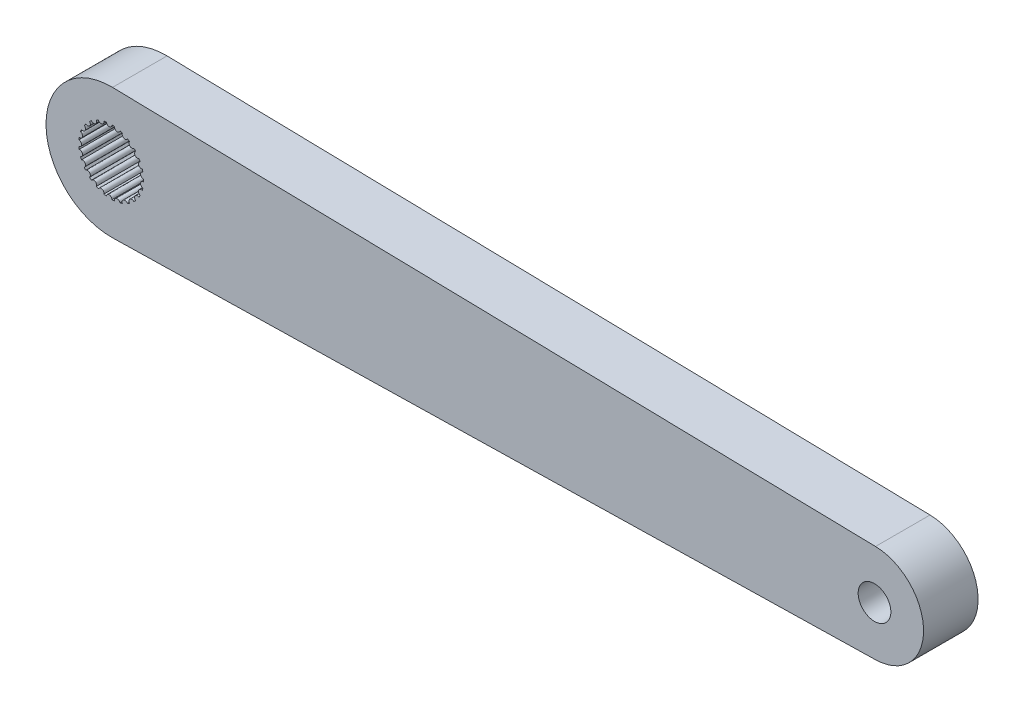
from build123d import *

# Parameters (mm, degrees)
ESQUISSE1_R        = 2.975
ESQUISSE1_R_2      = 1.5
BOSS_EXTRU_1_DEPTH = 5
ESQUISSE2_R        = 0.26
BOSS_EXTRU_2_DEPTH = 5


with BuildPart() as part:
    # Esquisse1 → Boss.-Extru.1 (new body)
    with BuildSketch(Plane.XY):
        with BuildLine():
            Line((0.125901786, 5.973673387), (70.094821429, 4.499000878))
            ThreePointArc((70.094821429, 4.499000878), (74.5, 0), (70.094821429, -4.499000878))
            Line((70.094821429, -4.499000878), (0.125901786, -5.973673387))
            ThreePointArc((0.125901786, -5.973673387), (-5.975, 0), (0.125901786, 5.973673387))
        make_face()
        Circle(ESQUISSE1_R, mode=Mode.SUBTRACT)
        with Locations((70, 0)):
            Circle(ESQUISSE1_R_2, mode=Mode.SUBTRACT)
    extrude(amount=BOSS_EXTRU_1_DEPTH)

    # Esquisse2 → Boss.-Extru.2 (add)
    with BuildSketch(Plane.XY.offset(5)):
        with Locations((2.951541236, 0.37286637)):
            Circle(ESQUISSE2_R)
        with Locations((2.951541236, -0.37286637)):
            Circle(ESQUISSE2_R)
        with Locations((2.766085046, -1.095170544)):
            Circle(ESQUISSE2_R)
        with Locations((2.406825558, -1.748661126)):
            Circle(ESQUISSE2_R)
        with Locations((1.89633637, -2.292276897)):
            Circle(ESQUISSE2_R)
        with Locations((1.266693392, -2.691860481)):
            Circle(ESQUISSE2_R)
        with Locations((0.557459411, -2.922304571)):
            Circle(ESQUISSE2_R)
        with Locations((-0.186801796, -2.969129517)):
            Circle(ESQUISSE2_R)
        with Locations((-0.919325558, -2.829393136)):
            Circle(ESQUISSE2_R)
        with Locations((-1.594084715, -2.511875578)):
            Circle(ESQUISSE2_R)
        with Locations((-2.168681667, -2.03652764)):
            Circle(ESQUISSE2_R)
        with Locations((-2.607012373, -1.43321718)):
            Circle(ESQUISSE2_R)
        with Locations((-2.881534904, -0.739852414)):
            Circle(ESQUISSE2_R)
        with Locations((-2.975, 0)):
            Circle(ESQUISSE2_R)
        with Locations((-2.881534904, 0.739852414)):
            Circle(ESQUISSE2_R)
        with Locations((-2.607012373, 1.43321718)):
            Circle(ESQUISSE2_R)
        with Locations((-2.168681667, 2.03652764)):
            Circle(ESQUISSE2_R)
        with Locations((-1.594084715, 2.511875578)):
            Circle(ESQUISSE2_R)
        with Locations((-0.919325558, 2.829393136)):
            Circle(ESQUISSE2_R)
        with Locations((-0.186801796, 2.969129517)):
            Circle(ESQUISSE2_R)
        with Locations((0.557459411, 2.922304571)):
            Circle(ESQUISSE2_R)
        with Locations((1.266693392, 2.691860481)):
            Circle(ESQUISSE2_R)
        with Locations((1.89633637, 2.292276897)):
            Circle(ESQUISSE2_R)
        with Locations((2.406825558, 1.748661126)):
            Circle(ESQUISSE2_R)
        with Locations((2.766085046, 1.095170544)):
            Circle(ESQUISSE2_R)
    extrude(amount=-BOSS_EXTRU_2_DEPTH)


solid = part.part
